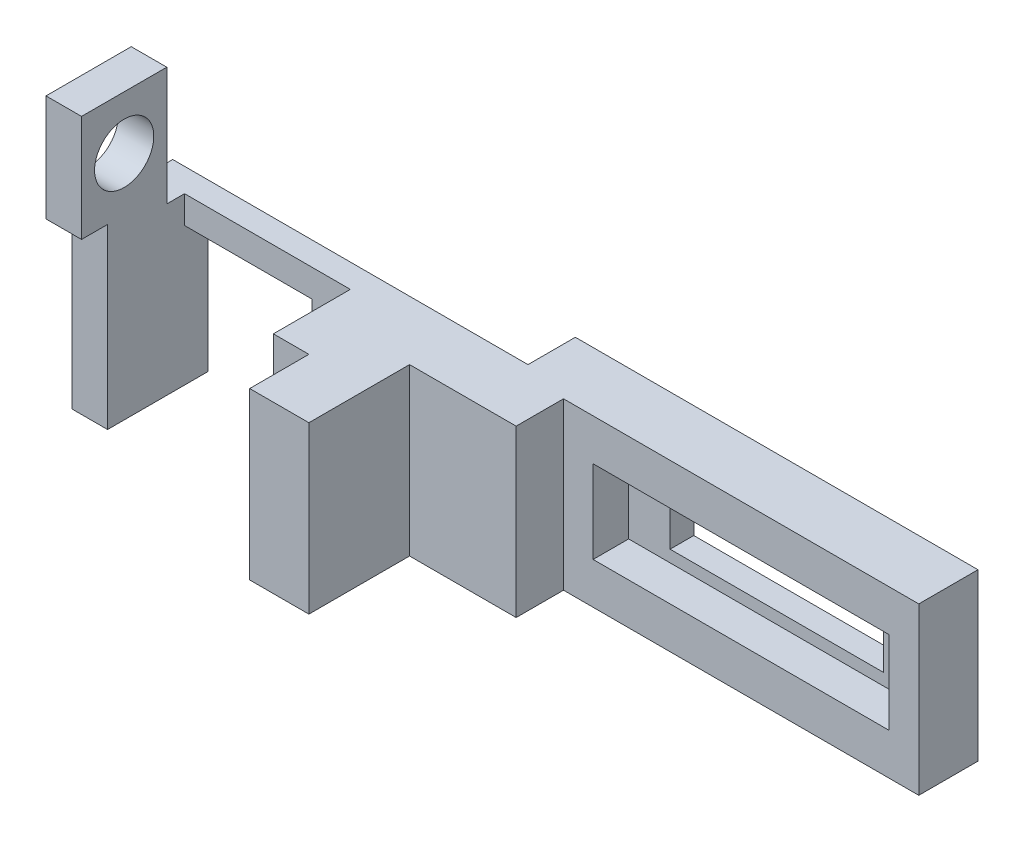
from build123d import *

# Parameters (mm, degrees)
BOSS_EXTRUDE1_DEPTH      = 14
SKETCH2_W                = 25
SKETCH2_H                = 7
CUT_EXTRUDE3_DEPTH       = 3
SKETCH10_W               = 18
SKETCH10_H               = 5
CUT_EXTRUDE4_DEPTH       = 68.321987493
BOSS_EXTRUDE8_DEPTH      = 3
SKETCH15_R               = 2.5
CUT_EXTRUDE8_DEPTH       = 71.556714776
CUT_EXTRUDE11_DEPTH      = 7
CUT_EXTRUDE11_DEPTH_BACK = 7
SKETCH18_W               = 6.5
SKETCH18_H               = 14
SKETCH19_W               = 10.762656819
SKETCH19_H               = 11.671990231
CUT_EXTRUDE12_DEPTH      = 7


with BuildPart() as part:
    # Sketch1 → Boss-Extrude1 (new body)
    with BuildSketch(Plane(origin=(0, 0, 0), x_dir=(1, 0, 0), z_dir=(0, 1, 0))):
        Polygon((25, 0), (25, 8.5), (34, 8.5), (34, 12.5), (64, 12.5), (64, 17.5), (30, 17.5), (30, 13.5), (0, 13.5), (0, 5), (20, 5), (20, 0), align=None)
    extrude(amount=BOSS_EXTRUDE1_DEPTH)

    # Sketch2 → Cut-Extrude3 (cut)
    with BuildSketch(Plane.XY.offset(-12.5)):
        with Locations((49, 7)):
            Rectangle(SKETCH2_W, SKETCH2_H)
    extrude(amount=-CUT_EXTRUDE3_DEPTH, mode=Mode.SUBTRACT)

    # Sketch10 → Cut-Extrude4 (cut, through all)
    with BuildSketch(Plane.XY.offset(-15.5)):
        with Locations((49, 7)):
            Rectangle(SKETCH10_W, SKETCH10_H)
    extrude(amount=-CUT_EXTRUDE4_DEPTH, mode=Mode.SUBTRACT)

    # Sketch11 → Boss-Extrude8 (add)
    with BuildSketch(Plane.ZY):
        Polygon((-10, 14), (-10, 24), (-2.800888244, 24), (-2.800888244, 15), (-5, 15), (-5, 14), align=None)
    extrude(amount=-BOSS_EXTRUDE8_DEPTH)

    # Sketch15 → Cut-Extrude8 (cut, through all)
    with BuildSketch(Plane.ZY):
        with Locations((-6.400444122, 19.5)):
            Circle(SKETCH15_R)
    extrude(amount=-CUT_EXTRUDE8_DEPTH, mode=Mode.SUBTRACT)

    # Sketch18 → Cut-Extrude11 (cut, two sides: drawn at the far end of the back side and taken through both)
    with BuildSketch(Plane.ZY.offset(-10).offset(-CUT_EXTRUDE11_DEPTH_BACK)):
        with Locations((-8.25, 7)):
            Rectangle(SKETCH18_W, SKETCH18_H)
    extrude(amount=CUT_EXTRUDE11_DEPTH + CUT_EXTRUDE11_DEPTH_BACK, mode=Mode.SUBTRACT)

    # Sketch19 → Cut-Extrude12 (cut)
    with BuildSketch(Plane(origin=(0, 0, -13.5), x_dir=(-1, 0, 0), z_dir=(0, 0, -1))):
        with Locations((-8.38132841, 5.835995116)):
            Rectangle(SKETCH19_W, SKETCH19_H)
    extrude(amount=-CUT_EXTRUDE12_DEPTH, mode=Mode.SUBTRACT)


solid = part.part
